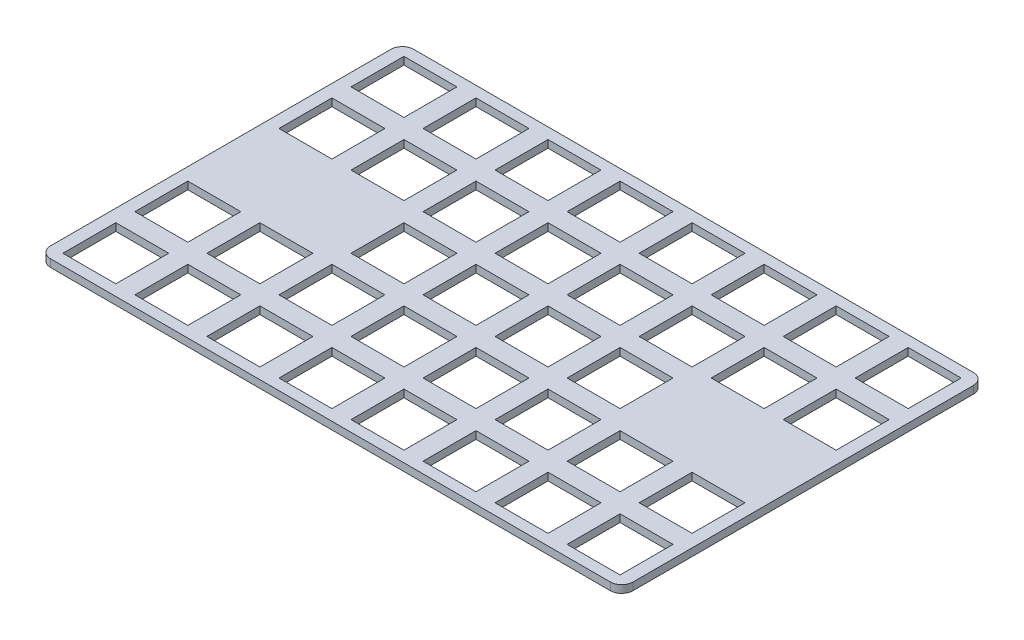
from build123d import *

# Parameters (mm, degrees)
BOSS_EXTRUDE1_DEPTH     = 2
CUT_EXTRUDE3_DEPTH      = 178.128669687
CUT_EXTRUDE3_DEPTH_BACK = 178.128669687
SKETCH14_W              = 14
SKETCH14_H              = 14


with BuildPart() as part:
    # Sketch16 → Boss-Extrude1 (new body)
    with BuildSketch(Plane(origin=(0, 0, 0), x_dir=(1, 0, 0), z_dir=(0, 1, 0))):
        with BuildLine():
            Line((-0.325, 93.1), (147.675, 93.1))
            ThreePointArc((147.675, 93.1), (149.796320344, 92.221320344), (150.675, 90.1))
            Line((150.675, 90.1), (150.675, 0.1))
            ThreePointArc((150.675, 0.1), (149.796320344, -2.021320344), (147.675, -2.9))
            Line((147.675, -2.9), (-0.325, -2.9))
            ThreePointArc((-0.325, -2.9), (-2.446320344, -2.021320344), (-3.325, 0.1))
            Line((-3.325, 0.1), (-3.325, 90.1))
            ThreePointArc((-3.325, 90.1), (-2.446320344, 92.221320344), (-0.325, 93.1))
        make_face()
    extrude(amount=BOSS_EXTRUDE1_DEPTH)

    # Sketch14 → Cut-Extrude3 (cut, two sides: drawn at the far end of the back side and taken through both)
    with BuildSketch(Plane(origin=(0, 0, 0), x_dir=(1, 0, 0), z_dir=(0, 1, 0)).offset(-CUT_EXTRUDE3_DEPTH_BACK)):
        with Locations((26.05, 7)):
            Rectangle(SKETCH14_W, SKETCH14_H)
        with Locations((7, 7)):
            Rectangle(SKETCH14_W, SKETCH14_H)
        with Locations((45.1, 7)):
            Rectangle(SKETCH14_W, SKETCH14_H)
        with Locations((64.15, 7)):
            Rectangle(SKETCH14_W, SKETCH14_H)
        with Locations((83.2, 7)):
            Rectangle(SKETCH14_W, SKETCH14_H)
        with Locations((102.25, 7)):
            Rectangle(SKETCH14_W, SKETCH14_H)
        with Locations((121.3, 7)):
            Rectangle(SKETCH14_W, SKETCH14_H)
        with Locations((140.35, 7)):
            Rectangle(SKETCH14_W, SKETCH14_H)
        with Locations((26.05, 26.05)):
            Rectangle(SKETCH14_W, SKETCH14_H)
        with Locations((45.1, 26.05)):
            Rectangle(SKETCH14_W, SKETCH14_H)
        with Locations((64.15, 26.05)):
            Rectangle(SKETCH14_W, SKETCH14_H)
        with Locations((83.2, 26.05)):
            Rectangle(SKETCH14_W, SKETCH14_H)
        with Locations((102.25, 26.05)):
            Rectangle(SKETCH14_W, SKETCH14_H)
        with Locations((121.3, 26.05)):
            Rectangle(SKETCH14_W, SKETCH14_H)
        with Locations((140.35, 26.05)):
            Rectangle(SKETCH14_W, SKETCH14_H)
        with Locations((45.1, 45.1)):
            Rectangle(SKETCH14_W, SKETCH14_H)
        with Locations((64.15, 45.1)):
            Rectangle(SKETCH14_W, SKETCH14_H)
        with Locations((83.2, 45.1)):
            Rectangle(SKETCH14_W, SKETCH14_H)
        with Locations((102.25, 45.1)):
            Rectangle(SKETCH14_W, SKETCH14_H)
        with Locations((26.05, 64.15)):
            Rectangle(SKETCH14_W, SKETCH14_H)
        with Locations((45.1, 64.15)):
            Rectangle(SKETCH14_W, SKETCH14_H)
        with Locations((64.15, 64.15)):
            Rectangle(SKETCH14_W, SKETCH14_H)
        with Locations((83.2, 64.15)):
            Rectangle(SKETCH14_W, SKETCH14_H)
        with Locations((102.25, 64.15)):
            Rectangle(SKETCH14_W, SKETCH14_H)
        with Locations((121.3, 64.15)):
            Rectangle(SKETCH14_W, SKETCH14_H)
        with Locations((140.35, 64.15)):
            Rectangle(SKETCH14_W, SKETCH14_H)
        with Locations((26.05, 83.2)):
            Rectangle(SKETCH14_W, SKETCH14_H)
        with Locations((45.1, 83.2)):
            Rectangle(SKETCH14_W, SKETCH14_H)
        with Locations((64.15, 83.2)):
            Rectangle(SKETCH14_W, SKETCH14_H)
        with Locations((83.2, 83.2)):
            Rectangle(SKETCH14_W, SKETCH14_H)
        with Locations((102.25, 83.2)):
            Rectangle(SKETCH14_W, SKETCH14_H)
        with Locations((121.3, 83.2)):
            Rectangle(SKETCH14_W, SKETCH14_H)
        with Locations((140.35, 83.2)):
            Rectangle(SKETCH14_W, SKETCH14_H)
        with Locations((7, 26.05)):
            Rectangle(SKETCH14_W, SKETCH14_H)
        with Locations((7, 64.15)):
            Rectangle(SKETCH14_W, SKETCH14_H)
        with Locations((7, 83.2)):
            Rectangle(SKETCH14_W, SKETCH14_H)
    extrude(amount=CUT_EXTRUDE3_DEPTH + CUT_EXTRUDE3_DEPTH_BACK, mode=Mode.SUBTRACT)


solid = part.part
